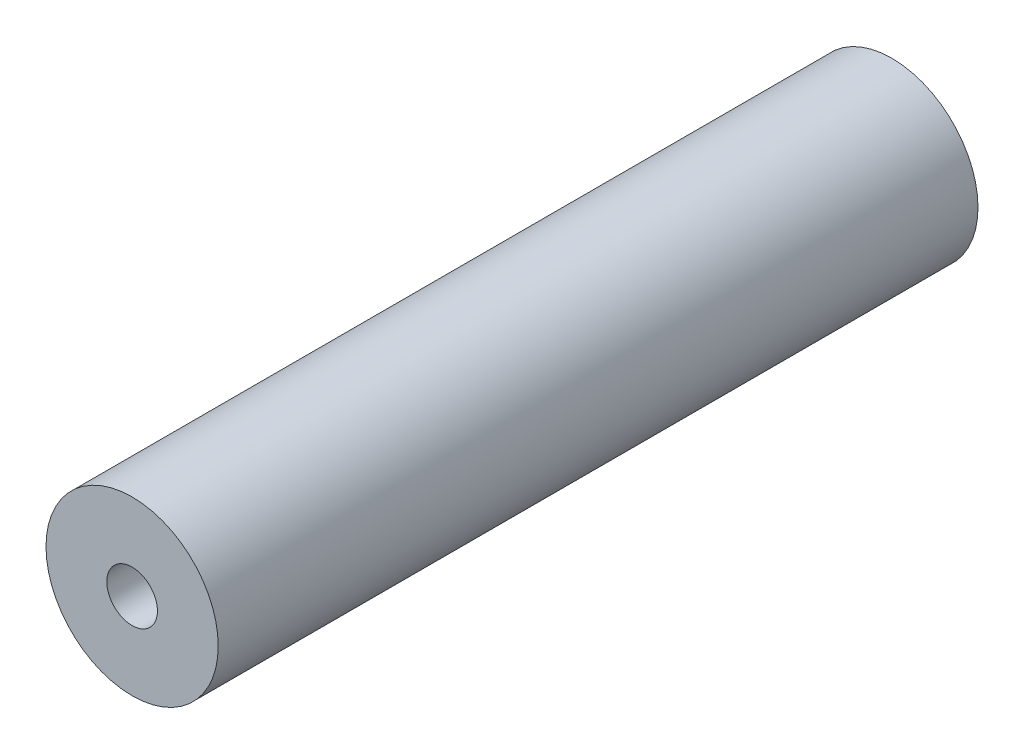
from build123d import *

# Parameters (mm, degrees)
SKETCH1_R           = 17
BOSS_EXTRUDE1_DEPTH = 150
SKETCH2_R           = 5
CUT_EXTRUDE1_DEPTH  = 150


with BuildPart() as part:
    # Sketch1 → Boss-Extrude1 (new body)
    with BuildSketch(Plane.XY):
        Circle(SKETCH1_R)
    extrude(amount=BOSS_EXTRUDE1_DEPTH)

    # Sketch2 → Cut-Extrude1 (cut)
    with BuildSketch(Plane.XY.offset(150)):
        Circle(SKETCH2_R)
    extrude(amount=-CUT_EXTRUDE1_DEPTH, mode=Mode.SUBTRACT)


solid = part.part
